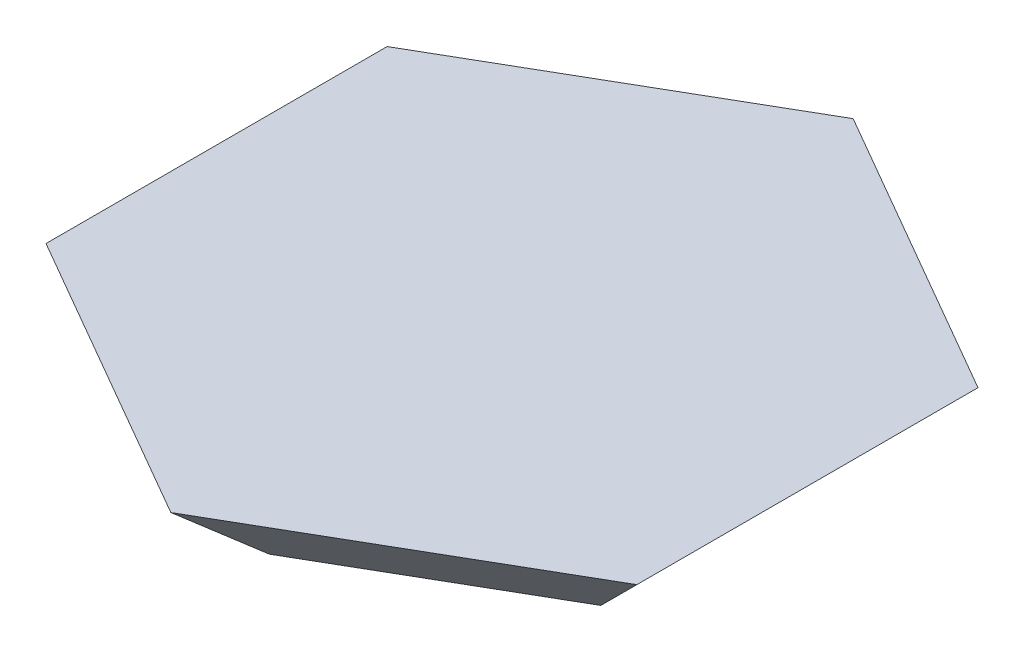
from build123d import *

# Parameters (mm, degrees)
RESSALTO_EXTRUS_O1_DEPTH = 130
CHANFRO1_SIZE            = 30
CORTE_EXTRUS_O1_DEPTH    = 50
ESBO_O5_R                = 15
CORTE_EXTRUS_O2_DEPTH    = 293.06163733
CASCA1_T                 = 10


with BuildPart() as part:
    # Esboço1 → Ressalto-extrusão1 (new body)
    with BuildSketch(Plane(origin=(0, 0, 0), x_dir=(1, 0, 0), z_dir=(0, 1, 0))):
        Polygon((0, 120), (-103.923048454, 60), (-103.923048454, -60), (0, -120), (103.923048454, -60), (103.923048454, 60), align=None)
    extrude(amount=-RESSALTO_EXTRUS_O1_DEPTH)

    # Chanfro1
    chanfro1_edges = [part.edges().sort_by_distance(p)[0] for p in [
        (-103.923048454, -130, 0),
        (-51.961524227, -130, 90),
        (51.961524227, -130, 90),
        (103.923048454, -130, 0),
        (51.961524227, -130, -90),
        (-51.961524227, -130, -90),
    ]]
    chamfer(chanfro1_edges, length=CHANFRO1_SIZE)

    # Esboço2 → Corte-extrusão1 (cut)
    with BuildSketch(Plane(origin=(0, 0, 0), x_dir=(1, 0, 0), z_dir=(0, 1, 0))):
        Polygon((0, 108.452994616), (-93.923048454, 54.226497308), (-93.923048454, -54.226497308), (0, -108.452994616), (93.923048454, -54.226497308), (93.923048454, 54.226497308), align=None)
    extrude(amount=-CORTE_EXTRUS_O1_DEPTH, mode=Mode.SUBTRACT)

    # Esboço5 → Corte-extrusão2 (cut, through all)
    with BuildSketch(Plane(origin=(-51.961524227, 0, 90), x_dir=(0.8660254037844417, 0, 0.49999999999999495), z_dir=(-0.49999999999999495, 0, 0.8660254037844417))):
        with Locations((0, -30)):
            Circle(ESBO_O5_R)
    extrude(amount=-CORTE_EXTRUS_O2_DEPTH, mode=Mode.SUBTRACT)

    # Corte de superfície1
    split(bisect_by=Plane(origin=(0, -50, 0), x_dir=(1, 0, 0), z_dir=(0, 1, 0)), keep=Keep.BOTTOM)

    # Corte de superfície2
    split(bisect_by=Plane(origin=(0, -100, 0), x_dir=(1, 0, 0), z_dir=(0, 1, 0)), keep=Keep.BOTTOM)

    # Casca1 (no face opened: a closed hollow body)
    add(offset(amount=-CASCA1_T, mode=Mode.PRIVATE), mode=Mode.SUBTRACT)


solid = part.part
